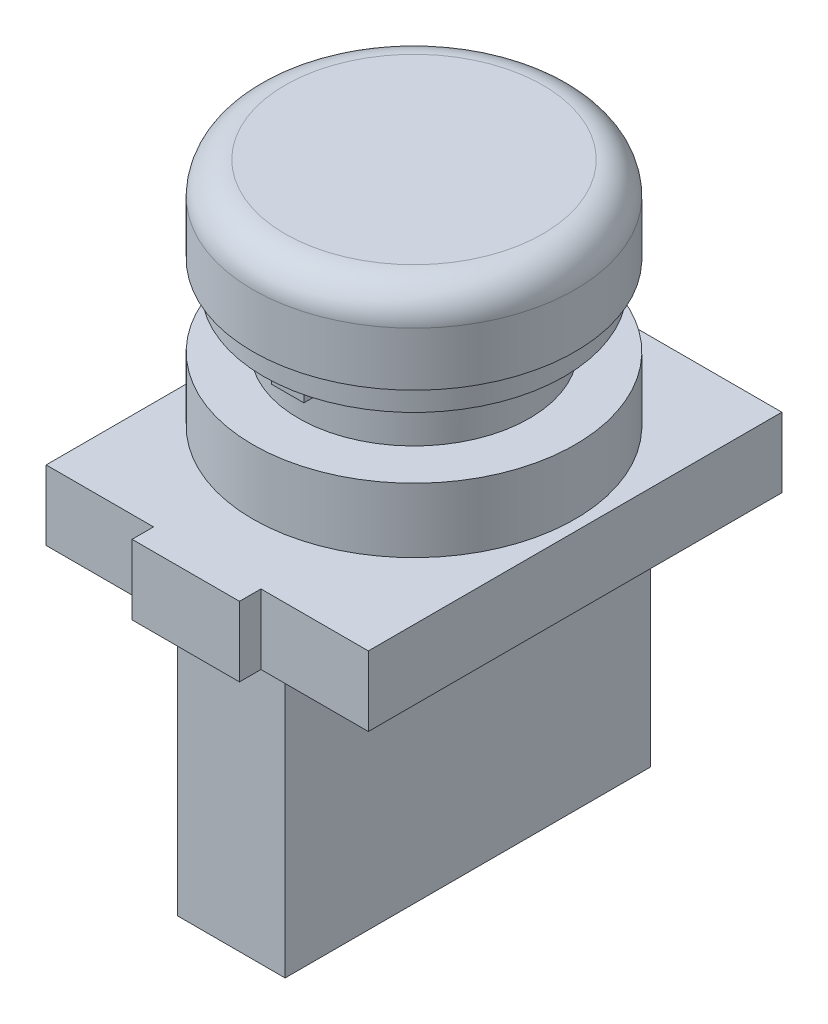
from build123d import *

# Parameters (mm, degrees)
SKIZZE1_R                       = 14
AUFSATZ_LINEAR_AUSTRAGEN1_DEPTH = 2.5
SKIZZE2_R                       = 15
AUFSATZ_LINEAR_AUSTRAGEN2_DEPTH = 8
VERRUNDUNG1_R                   = 3
SKIZZE3_R                       = 10.75
SKIZZE3_W                       = 3
SKIZZE3_H                       = 2
AUFSATZ_LINEAR_AUSTRAGEN3_DEPTH = 2.5
SKIZZE4_R                       = 10.75
AUFSATZ_LINEAR_AUSTRAGEN4_DEPTH = 2.5
AUFSATZ_LINEAR_START            = 6
SKIZZE5_R                       = 15
AUFSATZ_LINEAR_AUSTRAGEN5_DEPTH = 6
SKIZZE6_R                       = 10.75
AUFSATZ_LINEAR_AUSTRAGEN6_DEPTH = 1
SKIZZE7_W                       = 30
SKIZZE7_H                       = 38.5
SKIZZE7_W_2                     = 10
SKIZZE7_H_2                     = 4
AUFSATZ_LINEAR_AUSTRAGEN7_DEPTH = 6.5
SKIZZE8_W                       = 10
SKIZZE8_H                       = 34
AUFSATZ_LINEAR_AUSTRAGEN8_DEPTH = 26


with BuildPart() as part:
    # Skizze1 → Aufsatz-Linear austragen1 (new body)
    with BuildSketch(Plane(origin=(0, 0, 0), x_dir=(1, 0, 0), z_dir=(0, 1, 0))):
        with Locations(Location((0, 0, 0), (0, 0, 270))):
            Circle(SKIZZE1_R)
    extrude(amount=AUFSATZ_LINEAR_AUSTRAGEN1_DEPTH)

    # Skizze2 → Aufsatz-Linear austragen2 (add)
    with BuildSketch(Plane(origin=(0, 2.5, 0), x_dir=(1, 0, 0), z_dir=(0, 1, 0))):
        with Locations(Location((0, 0, 0), (0, 0, 270))):
            Circle(SKIZZE2_R)
    extrude(amount=AUFSATZ_LINEAR_AUSTRAGEN2_DEPTH)

    # Verrundung1
    verrundung1_edges = [part.edges().sort_by_distance(p)[0] for p in [
        (0, 10.5, -15),
    ]]
    fillet(verrundung1_edges, radius=VERRUNDUNG1_R)

    # Skizze3 → Aufsatz-Linear austragen3 (add)
    with BuildSketch(Plane.XZ):
        Circle(SKIZZE3_R)
        with Locations((0, 10.75)):
            Rectangle(SKIZZE3_W, SKIZZE3_H)
    extrude(amount=AUFSATZ_LINEAR_AUSTRAGEN3_DEPTH)

    # Skizze4 → Aufsatz-Linear austragen4 (add)
    with BuildSketch(Plane.XZ.offset(2.5)):
        with Locations(Location((0, 0, 0), (0, 0, 81.979067125))):
            Circle(SKIZZE4_R)
    extrude(amount=AUFSATZ_LINEAR_AUSTRAGEN4_DEPTH)

    # Skizze5 → Aufsatz-Linear austragen5 (add)
    with BuildSketch(Plane.XZ.offset(5).offset(AUFSATZ_LINEAR_START)):
        with Locations(Location((0, 0, 0), (0, 0, 90))):
            Circle(SKIZZE5_R)
    extrude(amount=-AUFSATZ_LINEAR_AUSTRAGEN5_DEPTH)

    # Skizze6 → Aufsatz-Linear austragen6 (add)
    with BuildSketch(Plane.XZ.offset(11)):
        with Locations(Location((0, 0, 0), (0, 0, 81.979067125))):
            Circle(SKIZZE6_R)
    extrude(amount=AUFSATZ_LINEAR_AUSTRAGEN6_DEPTH)


with BuildPart() as body_2:
    # Skizze7 → Aufsatz-Linear austragen7 (new body)
    with BuildSketch(Plane.XZ.offset(12)):
        Rectangle(SKIZZE7_W, SKIZZE7_H)
        with Locations((0, 19.25)):
            Rectangle(SKIZZE7_W_2, SKIZZE7_H_2)
    extrude(amount=AUFSATZ_LINEAR_AUSTRAGEN7_DEPTH)

    # Skizze8 → Aufsatz-Linear austragen8 (add)
    with BuildSketch(Plane.XZ.offset(18.5)):
        Rectangle(SKIZZE8_W, SKIZZE8_H)
    extrude(amount=AUFSATZ_LINEAR_AUSTRAGEN8_DEPTH)


solid = Compound([part.part, body_2.part])
